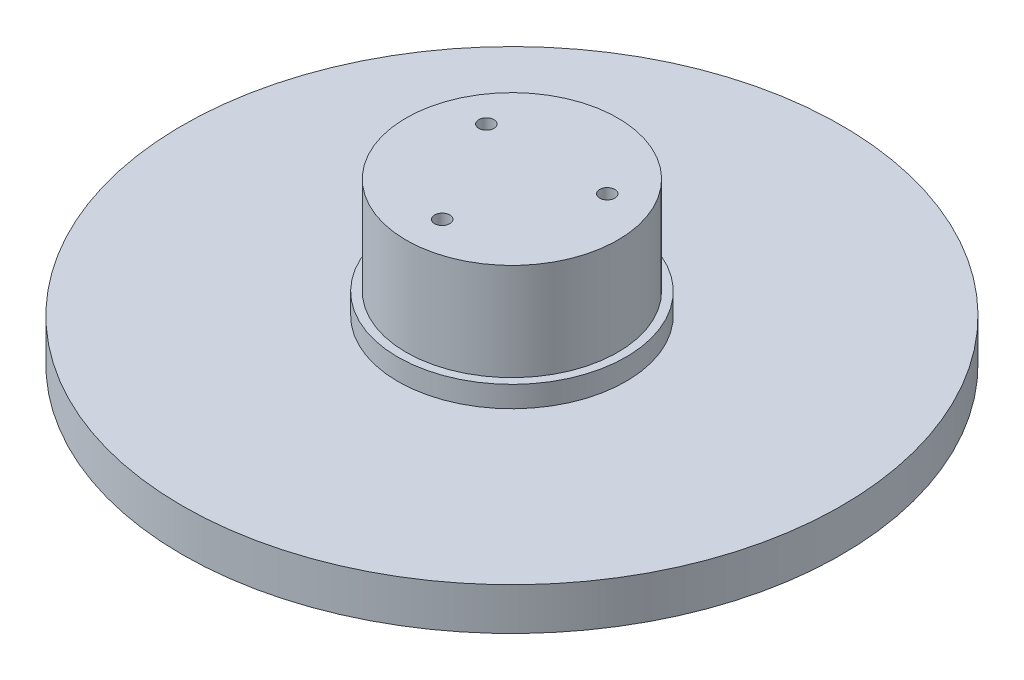
from build123d import *

# Parameters (mm, degrees)
SKETCH1_R                     = 78
BOSS_EXTRUDE1_DEPTH           = 10
SKETCH2_R                     = 27
BOSS_EXTRUDE2_DEPTH           = 5
SKETCH3_R                     = 25.05
BOSS_EXTRUDE3_DEPTH           = 23
CBORE_FOR_M3_SHCS1_AT_2_COUNT = 2
CBORE_FOR_M3_SHCS1_AT_2_PITCH = 28.596158833
CBORE_FOR_M3_SHCS1_AT_3_COUNT = 2
CBORE_FOR_M3_SHCS1_AT_3_PITCH = 28.596158833


with BuildPart() as part:
    # Sketch1 → Boss-Extrude1 (new body)
    with BuildSketch(Plane(origin=(0, 0, 0), x_dir=(1, 0, 0), z_dir=(0, 1, 0))):
        with Locations(Location((0, 0, 0), (0, 0, 270))):
            Circle(SKETCH1_R)
    extrude(amount=BOSS_EXTRUDE1_DEPTH)

    # Sketch2 → Boss-Extrude2 (add)
    with BuildSketch(Plane(origin=(0, 10, 0), x_dir=(1, 0, 0), z_dir=(0, 1, 0))):
        with Locations(Location((0, 0, 0), (0, 0, 270))):
            Circle(SKETCH2_R)
    extrude(amount=BOSS_EXTRUDE2_DEPTH)

    # Sketch3 → Boss-Extrude3 (add)
    with BuildSketch(Plane(origin=(0, 15, 0), x_dir=(1, 0, 0), z_dir=(0, 1, 0))):
        with Locations(Location((0, 0, 0), (0, 0, 270))):
            Circle(SKETCH3_R)
    extrude(amount=BOSS_EXTRUDE3_DEPTH)

    # Sketch5 → CBORE for M3 SHCS1 (revolve, cut)
    with BuildSketch(Plane(origin=(0, 0, 16.51), x_dir=(0, 0, -1), z_dir=(1, 0, 0))):
        Polygon((0, 0), (0, 38), (1.8, 38), (1.8, 23), (3.25, 23), (3.25, 0.025), (3.275, 0), align=None)
    cbore_for_m3_shcs1 = revolve(axis=Axis((0, -6.35, 16.51), (0, 1, 0)), mode=Mode.SUBTRACT)

    # CBORE for M3 SHCS1 at 2: CBORE for M3 SHCS1 ×2
    with Locations(*[Vector(0.5000000000000012, 0, -0.8660254037844379) * (i * CBORE_FOR_M3_SHCS1_AT_2_PITCH) for i in range(1, CBORE_FOR_M3_SHCS1_AT_2_COUNT)]):
        add(cbore_for_m3_shcs1, mode=Mode.SUBTRACT)

    # CBORE for M3 SHCS1 at 3: CBORE for M3 SHCS1 ×2
    with Locations(*[Vector(-0.4999999999999978, 0, -0.8660254037844399) * (i * CBORE_FOR_M3_SHCS1_AT_3_PITCH) for i in range(1, CBORE_FOR_M3_SHCS1_AT_3_COUNT)]):
        add(cbore_for_m3_shcs1, mode=Mode.SUBTRACT)


solid = part.part
